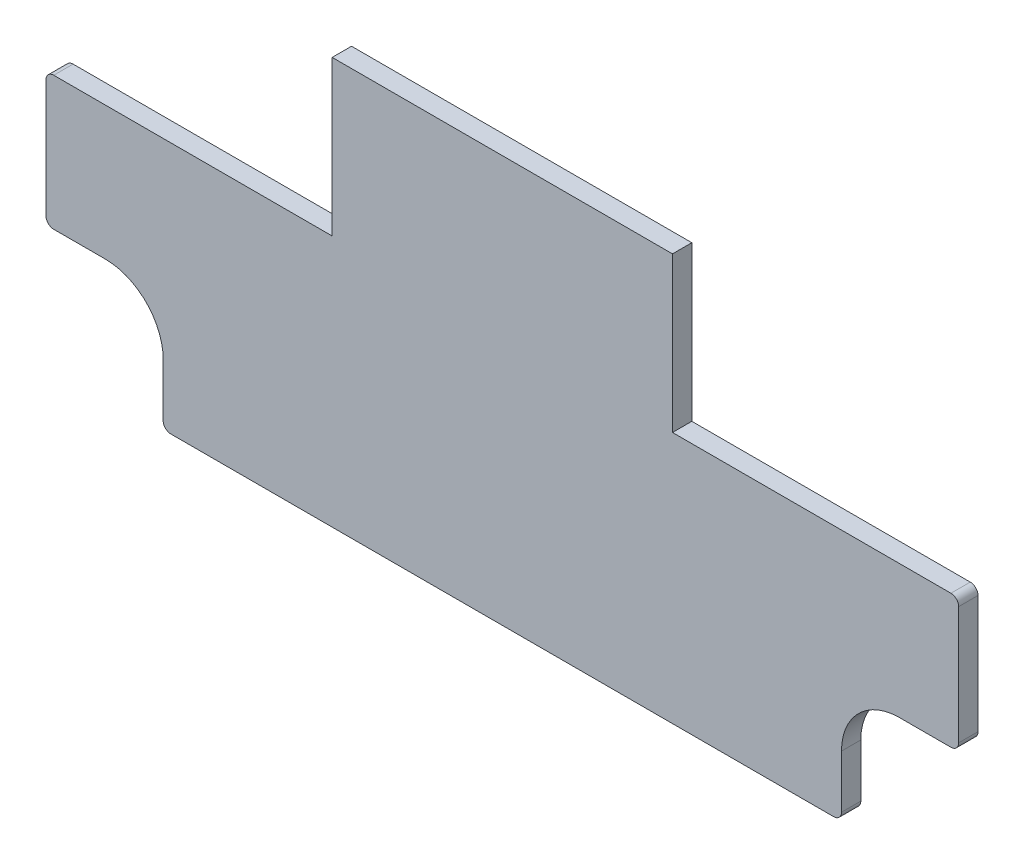
from build123d import *

# Parameters (mm, degrees)
BOSS_EXTRU_1_DEPTH = 5
CONG_1_R           = 2


with BuildPart() as part:
    # Esquisse1 → Boss.-Extru.1 (new body)
    with BuildSketch(Plane.XY):
        Polygon((30.3, 15.7), (30.3, 0), (205.7, 0), (205.7, 15.7), (205.7, 30.7), (220.7, 30.7), (236, 30.7), (236, 65.2), (162, 65.2), (162, 105.2), (74, 105.2), (74, 65.2), (0, 65.2), (0, 30.7), (15.3, 30.7), (30.3, 30.7), align=None)
        with BuildLine():
            ThreePointArc((15.3, 30.7), (25.906601718, 26.306601718), (30.3, 15.7))
            Line((30.3, 15.7), (30.3, 30.7))
            Line((30.3, 30.7), (15.3, 30.7))
        make_face()
        with BuildLine():
            Line((205.7, 30.7), (205.7, 15.7))
            ThreePointArc((205.7, 15.7), (210.093398282, 26.306601718), (220.7, 30.7))
            Line((220.7, 30.7), (205.7, 30.7))
        make_face()
    extrude(amount=BOSS_EXTRU_1_DEPTH)

    # Congé1
    cong_1_edges = [part.edges().sort_by_distance(p)[0] for p in [
        (205.7, 0, 2.5),
        (30.3, 0, 2.5),
        (0, 30.7, 2.5),
        (0, 65.2, 2.5),
        (236, 65.2, 2.5),
        (236, 30.7, 2.5),
    ]]
    fillet(cong_1_edges, radius=CONG_1_R)


solid = part.part
